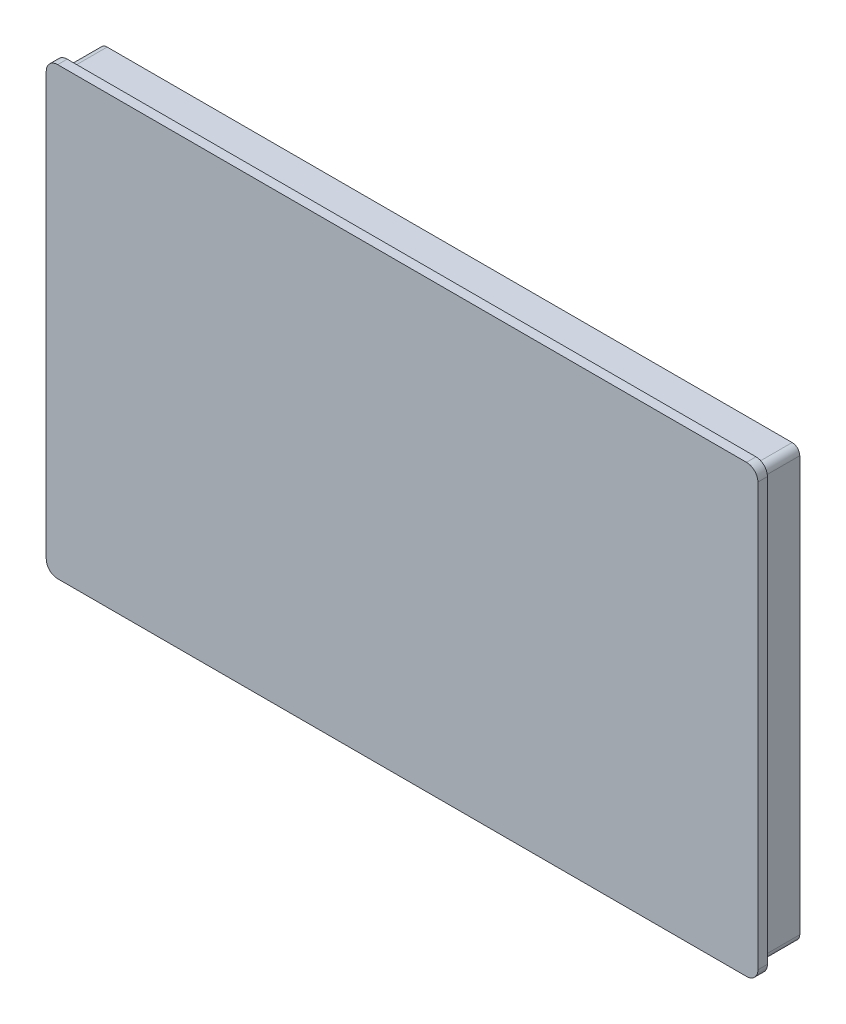
from build123d import *

# Parameters (mm, degrees)
SCHIZZO1_W                   = 184
SCHIZZO1_H                   = 113
ESTRUSIONE_ESTRUSIONE1_DEPTH = 10
RACCORDO1_R                  = 2
RACCORDO2_R                  = 2
RACCORDO3_R                  = 2
RACCORDO4_R                  = 2
SCHIZZO2_W                   = 187
SCHIZZO2_H                   = 117
ESTRUSIONE_ESTRUSIONE2_DEPTH = 2.5
RACCORDO5_R                  = 3
RACCORDO6_R                  = 3
RACCORDO7_R                  = 3
RACCORDO8_R                  = 3


with BuildPart() as part:
    # Schizzo1 → Estrusione-Estrusione1 (new body)
    with BuildSketch(Plane.XY):
        Rectangle(SCHIZZO1_W, SCHIZZO1_H)
    extrude(amount=ESTRUSIONE_ESTRUSIONE1_DEPTH)

    # Raccordo1
    raccordo1_edges = [part.edges().sort_by_distance(p)[0] for p in [
        (-92, 56.5, 5),
    ]]
    fillet(raccordo1_edges, radius=RACCORDO1_R)

    # Raccordo2
    raccordo2_edges = [part.edges().sort_by_distance(p)[0] for p in [
        (-92, -56.5, 5),
    ]]
    fillet(raccordo2_edges, radius=RACCORDO2_R)

    # Raccordo3
    raccordo3_edges = [part.edges().sort_by_distance(p)[0] for p in [
        (92, -56.5, 5),
    ]]
    fillet(raccordo3_edges, radius=RACCORDO3_R)

    # Raccordo4
    raccordo4_edges = [part.edges().sort_by_distance(p)[0] for p in [
        (92, 56.5, 5),
    ]]
    fillet(raccordo4_edges, radius=RACCORDO4_R)

    # Schizzo2 → Estrusione-Estrusione2 (add)
    with BuildSketch(Plane.XY.offset(10)):
        Rectangle(SCHIZZO2_W, SCHIZZO2_H)
    extrude(amount=ESTRUSIONE_ESTRUSIONE2_DEPTH)

    # Raccordo5
    raccordo5_edges = [part.edges().sort_by_distance(p)[0] for p in [
        (-93.5, 58.5, 11.25),
    ]]
    fillet(raccordo5_edges, radius=RACCORDO5_R)

    # Raccordo6
    raccordo6_edges = [part.edges().sort_by_distance(p)[0] for p in [
        (-93.5, -58.5, 11.25),
    ]]
    fillet(raccordo6_edges, radius=RACCORDO6_R)

    # Raccordo7
    raccordo7_edges = [part.edges().sort_by_distance(p)[0] for p in [
        (93.5, -58.5, 11.25),
    ]]
    fillet(raccordo7_edges, radius=RACCORDO7_R)

    # Raccordo8
    raccordo8_edges = [part.edges().sort_by_distance(p)[0] for p in [
        (93.5, 58.5, 11.25),
    ]]
    fillet(raccordo8_edges, radius=RACCORDO8_R)


solid = part.part
